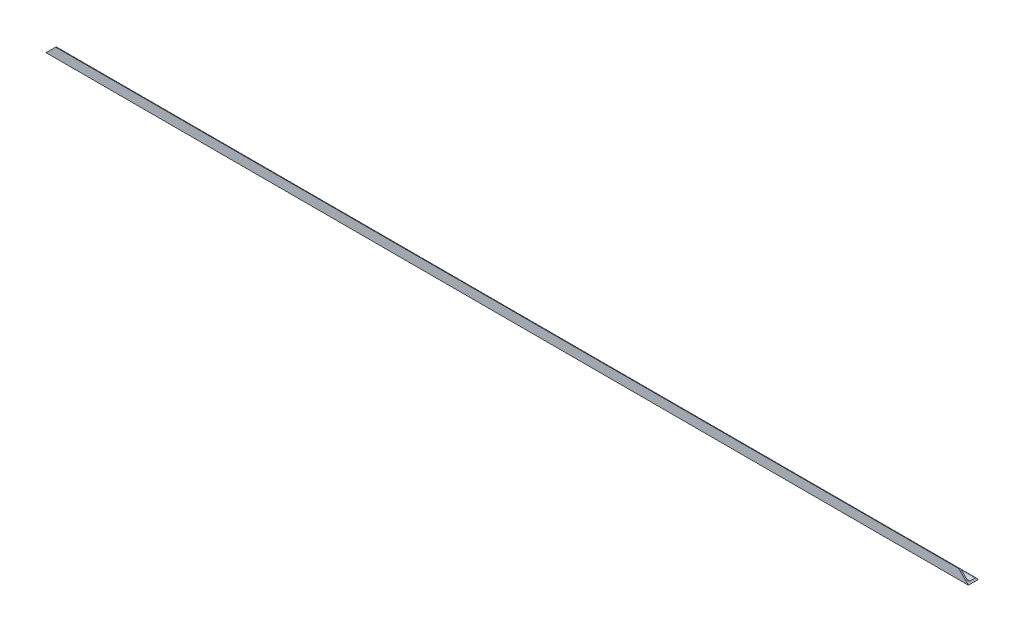
from build123d import *

# Parameters (mm, degrees)
L_ANGLE_EQUAL_20X20X3_2_DEPTH = 1920
CUT_EXTRUDE1_DEPTH            = 1921.208322032


with BuildPart() as part:
    # Sketch16 → L angle (equal) 20X20X3(2) (new body)
    with BuildSketch(Plane(origin=(0, 0, 0), x_dir=(0, 0, -1), z_dir=(1, 0, 0))):
        with BuildLine():
            Line((0, 20), (0, 0))
            Line((0, 0), (20, 0))
            ThreePointArc((20, 0), (19.121320344, 2.121320344), (17, 3))
            Line((17, 3), (6.5, 3))
            ThreePointArc((6.5, 3), (4.025126266, 4.025126266), (3, 6.5))
            Line((3, 6.5), (3, 17))
            ThreePointArc((3, 17), (2.121320344, 19.121320344), (0, 20))
        make_face()
    extrude(amount=L_ANGLE_EQUAL_20X20X3_2_DEPTH)

    # Sketch14 → Cut-Extrude1 (cut, through all)
    with BuildSketch(Plane.XY):
        Polygon((1920, 0), (1920, 20), (1900, 20), align=None)
        Polygon((0, 20), (0, 0), (20, 20), align=None)
    extrude(amount=-CUT_EXTRUDE1_DEPTH, mode=Mode.SUBTRACT)


solid = part.part
